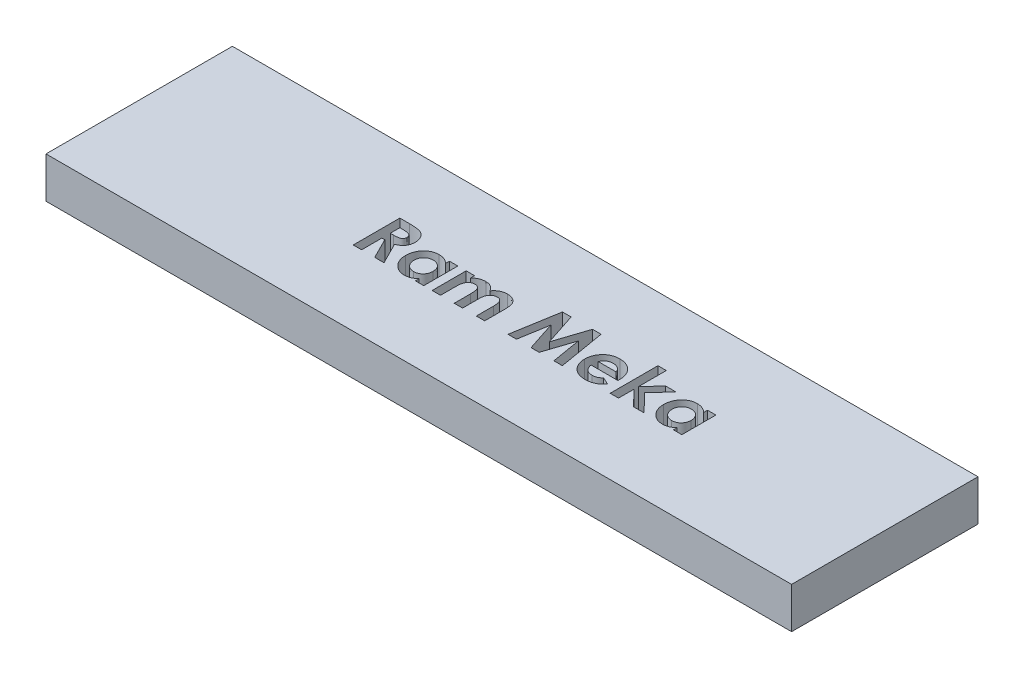
from build123d import *

# Parameters (mm, degrees)
SKETCH1_W           = 50.8
SKETCH1_H           = 12.7
BOSS_EXTRUDE2_DEPTH = 2.794
CUT_EXTRUDE1_DEPTH  = 27.330380476


with BuildPart() as part:
    # Sketch1 → Boss-Extrude2 (new body)
    with BuildSketch(Plane(origin=(0, 0, 0), x_dir=(1, 0, 0), z_dir=(0, 1, 0))):
        Rectangle(SKETCH1_W, SKETCH1_H)
    extrude(amount=-BOSS_EXTRUDE2_DEPTH)

    # Sketch3 → Cut-Extrude1 (cut, through all)
    # profile 1 of 7: a face of its own
    with BuildSketch(Plane(origin=(0, 0, 0), x_dir=(1, 0, 0), z_dir=(0, 1, 0))):
        with BuildLine():
            Line((-9.559377939, 1.918579229), (-8.895375535, 1.918579229))
            add(Edge.make_bspline(
                [(-8.895375535, 1.918579229), (-8.851485178, 1.918423443), (-8.767071659, 1.918123824), (-8.645351975, 1.913396621), (-8.533535705, 1.90681833), (-8.431457297, 1.896779684), (-8.339160421, 1.883469652), (-8.256552573, 1.867779328), (-8.183636169, 1.849896839), (-8.119796259, 1.827613847), (-8.062183896, 1.80247897), (-8.008481165, 1.773598536), (-7.957503303, 1.741294137), (-7.909591041, 1.704715756), (-7.864328012, 1.664521431), (-7.821628823, 1.620670702), (-7.782096854, 1.572791731), (-7.745976888, 1.521187055), (-7.713056446, 1.466900118), (-7.683961681, 1.409856386), (-7.660301769, 1.350016187), (-7.6393957, 1.288244343), (-7.624337737, 1.223657811), (-7.613865143, 1.156885354), (-7.60619752, 1.087691925), (-7.605756668, 1.040684981), (-7.605531785, 1.016706232)],
                knots=[0, 0, 0, 0, 1.749336639, 3.364467119, 4.854658419, 6.213483162, 7.451590619, 8.570285859, 9.5643256, 10.440900261, 11.26203566, 12.067320669, 12.869050712, 13.665104639, 14.467235401, 15.27997916, 16.102287765, 16.939272006, 17.78853747, 18.631303466, 19.488103222, 20.351255419, 21.228522269, 22.127379805, 23.044756219, 24, 24, 24, 24], degree=3))
            add(Edge.make_bspline(
                [(-7.605531785, 1.016706232), (-7.606115951, 0.991677926), (-7.607261393, 0.94260198), (-7.613431369, 0.870513417), (-7.624708148, 0.801544122), (-7.641788469, 0.73589603), (-7.66142008, 0.672752072), (-7.687525086, 0.613277295), (-7.716987166, 0.556606723), (-7.751978417, 0.503541985), (-7.790379607, 0.452904404), (-7.835039382, 0.406634097), (-7.883064476, 0.362244207), (-7.937154553, 0.322515168), (-7.994925274, 0.284760646), (-8.057524482, 0.250544994), (-8.124543632, 0.21900811), (-8.171661414, 0.201420965), (-8.195756144, 0.192427386)],
                knots=[0, 0, 0, 0, 1.099860209, 2.156625411, 3.176576793, 4.16617041, 5.135385252, 6.078461593, 7.016046972, 7.938469504, 8.868247731, 9.803980173, 10.76021508, 11.73834243, 12.748633912, 13.790971185, 14.870363756, 16, 16, 16, 16], degree=3))
            Line((-8.195756144, 0.192427386), (-7.463063836, -1.256420771))
            Line((-7.463063836, -1.256420771), (-8.096537394, -1.256420771))
            Line((-8.096537394, -1.256420771), (-8.796156785, 0.127553588))
            Line((-8.796156785, 0.127553588), (-8.989506144, 0.127553588))
            Line((-8.989506144, 0.127553588), (-8.989506144, -1.256420771))
            Line((-8.989506144, -1.256420771), (-9.559377939, -1.256420771))
            Line((-9.559377939, -1.256420771), (-9.559377939, 1.918579229))
        make_face()
        with BuildLine():
            Line((-8.989506144, 0.697425383), (-8.767535992, 0.697425383))
            add(Edge.make_bspline(
                [(-8.767535992, 0.697425383), (-8.740398296, 0.697731026), (-8.688435438, 0.698316266), (-8.613706025, 0.701030855), (-8.545833896, 0.707571672), (-8.484527584, 0.71583575), (-8.429478604, 0.725377821), (-8.381177971, 0.739052189), (-8.338881447, 0.75370462), (-8.303090247, 0.771913792), (-8.272511068, 0.792621568), (-8.246107904, 0.816146118), (-8.224268702, 0.843372788), (-8.206293925, 0.873561677), (-8.192311503, 0.906979796), (-8.182105405, 0.94326029), (-8.176401706, 0.982816442), (-8.175745476, 1.010115573), (-8.17540358, 1.024338444)],
                knots=[0, 0, 0, 0, 1.688639943, 3.233382647, 4.650958383, 5.928841754, 7.082724185, 8.122798841, 9.049171256, 9.863274652, 10.613301712, 11.341792392, 12.054588806, 12.776240173, 13.521029143, 14.301969904, 15.115324896, 16, 16, 16, 16], degree=3))
            add(Edge.make_bspline(
                [(-8.17540358, 1.024338444), (-8.176049966, 1.041165137), (-8.177319673, 1.074218059), (-8.189919105, 1.121802676), (-8.209974678, 1.165845495), (-8.237465377, 1.206147519), (-8.272086338, 1.241479056), (-8.311816623, 1.272624087), (-8.357513706, 1.297251247), (-8.399825766, 1.313495059), (-8.43831985, 1.3232139), (-8.473059547, 1.330456294), (-8.513288325, 1.335589186), (-8.559036555, 1.341033533), (-8.610187623, 1.344563916), (-8.667020333, 1.347140391), (-8.729371462, 1.348194554), (-8.77283612, 1.348531552), (-8.795520767, 1.348707434)],
                knots=[0, 0, 0, 0, 1.020303359, 2.004196876, 2.966617323, 3.9489082, 4.950758222, 5.960522915, 7.003732012, 8.091992268, 8.70421221, 9.413913587, 10.24622431, 11.166358409, 12.212345909, 13.359657661, 14.621978493, 16, 16, 16, 16], degree=3))
            Line((-8.795520767, 1.348707434), (-8.989506144, 1.348707434))
            Line((-8.989506144, 1.348707434), (-8.989506144, 0.697425383))
        make_face(mode=Mode.SUBTRACT)
    # profile 2 of 7: a face of its own
    with BuildSketch(Plane(origin=(0, 0, 0), x_dir=(1, 0, 0), z_dir=(0, 1, 0))):
        with BuildLine():
            Line((-5.326044606, 1.063771536), (-4.756172811, 1.063771536))
            Line((-4.756172811, 1.063771536), (-4.756172811, -1.256420771))
            Line((-4.756172811, -1.256420771), (-5.326044606, -1.256420771))
            Line((-5.326044606, -1.256420771), (-5.326044606, -1.003285755))
            add(Edge.make_bspline(
                [(-5.326044606, -1.003285755), (-5.354281543, -1.027925647), (-5.409083862, -1.075746812), (-5.495434585, -1.13779599), (-5.582037634, -1.188978541), (-5.66930914, -1.229742653), (-5.758590429, -1.259842753), (-5.850524291, -1.281635929), (-5.946434671, -1.294487898), (-6.011633226, -1.296237406), (-6.044744525, -1.297125899)],
                knots=[0, 0, 0, 0, 1.129196829, 2.191548051, 3.199897424, 4.157751732, 5.089409408, 6.034969131, 7.002052659, 8, 8, 8, 8], degree=3))
            add(Edge.make_bspline(
                [(-6.044744525, -1.297125899), (-6.081913431, -1.296289715), (-6.155361293, -1.294637368), (-6.263137878, -1.277243748), (-6.367206886, -1.250618935), (-6.467483841, -1.212941498), (-6.563786298, -1.164118925), (-6.656851265, -1.105425067), (-6.745083323, -1.034799417), (-6.829216974, -0.955297767), (-6.90624924, -0.867845387), (-6.973591574, -0.773656104), (-7.030356157, -0.674065783), (-7.076860342, -0.569404614), (-7.113441889, -0.459749412), (-7.139519298, -0.344752384), (-7.154904999, -0.224372457), (-7.156809315, -0.142374366), (-7.157775375, -0.100776741)],
                knots=[0, 0, 0, 0, 0.980476535, 1.937477201, 2.874147792, 3.812856188, 4.758993464, 5.720109578, 6.712210464, 7.737600662, 8.772720504, 9.783789959, 10.789002326, 11.793715968, 12.802552247, 13.835794126, 14.902098527, 16, 16, 16, 16], degree=3))
            add(Edge.make_bspline(
                [(-7.157775375, -0.100776741), (-7.156761492, -0.057702345), (-7.154772647, 0.026792882), (-7.140224368, 0.15078561), (-7.114628186, 0.26863398), (-7.079725951, 0.38050123), (-7.034830287, 0.486406686), (-6.980150368, 0.586523856), (-6.914942325, 0.680591048), (-6.839801615, 0.767007173), (-6.758668104, 0.846211726), (-6.67186959, 0.91516557), (-6.580763412, 0.97374507), (-6.485252754, 1.021568674), (-6.385351256, 1.058524335), (-6.281453327, 1.085541941), (-6.173097733, 1.101753453), (-6.099285024, 1.103561389), (-6.061917001, 1.104476665)],
                knots=[0, 0, 0, 0, 1.136281865, 2.228943489, 3.287578264, 4.313574083, 5.316051562, 6.317280042, 7.318008486, 8.329309503, 9.333984563, 10.305318864, 11.248632312, 12.186624717, 13.117503092, 14.05354244, 15.014596925, 16, 16, 16, 16], degree=3))
            add(Edge.make_bspline(
                [(-6.061917001, 1.104476665), (-6.027302104, 1.103757533), (-5.9588117, 1.102334631), (-5.858140675, 1.086884633), (-5.760504299, 1.063517608), (-5.666435186, 1.030223804), (-5.575161748, 0.988183603), (-5.488253947, 0.935504098), (-5.403810595, 0.874399384), (-5.352286874, 0.826675309), (-5.326044606, 0.802368291)],
                knots=[0, 0, 0, 0, 1.017011718, 2.012299608, 2.98747302, 3.965332399, 4.941441765, 5.936729654, 6.94912688, 8, 8, 8, 8], degree=3))
            Line((-5.326044606, 0.802368291), (-5.326044606, 1.063771536))
        make_face()
        with BuildLine():
            add(Edge.make_bspline(
                [(-5.942345687, 0.575309998), (-5.965053398, 0.574613247), (-6.00955903, 0.573247661), (-6.075010651, 0.565033563), (-6.137562766, 0.550559958), (-6.196769259, 0.529178313), (-6.253512523, 0.503132355), (-6.306930903, 0.470510222), (-6.357465277, 0.431951553), (-6.404818448, 0.388389854), (-6.44798784, 0.340507582), (-6.485202375, 0.288257649), (-6.516828718, 0.233047893), (-6.543576385, 0.174712319), (-6.562721645, 0.112560635), (-6.577884684, 0.047401947), (-6.585753319, -0.021296059), (-6.587179655, -0.068111625), (-6.58790358, -0.091872494)],
                knots=[0, 0, 0, 0, 1.04836806, 2.054732945, 3.03993516, 4.00574415, 4.955904794, 5.917688631, 6.888591924, 7.88601754, 8.884115178, 9.859153345, 10.841239365, 11.818093293, 12.814750328, 13.83810466, 14.90274714, 16, 16, 16, 16], degree=3))
            add(Edge.make_bspline(
                [(-6.58790358, -0.091872494), (-6.587190713, -0.115848888), (-6.585786016, -0.163094095), (-6.577757456, -0.232371594), (-6.563140046, -0.298482097), (-6.541813796, -0.360891148), (-6.515769498, -0.42044085), (-6.484067731, -0.476856375), (-6.445127662, -0.529140227), (-6.401920428, -0.578529617), (-6.353595814, -0.622632426), (-6.302775496, -0.661791671), (-6.248765307, -0.694556186), (-6.192151221, -0.721036674), (-6.133123803, -0.742616046), (-6.070943027, -0.756907748), (-6.006218033, -0.766044163), (-5.962093296, -0.767316468), (-5.939801617, -0.767959233)],
                knots=[0, 0, 0, 0, 1.099136573, 2.165835871, 3.191374663, 4.196217796, 5.183857741, 6.167377911, 7.154730987, 8.166690795, 9.170734848, 10.148332609, 11.103258353, 12.059567475, 13.009337315, 13.978056681, 14.978520572, 16, 16, 16, 16], degree=3))
            add(Edge.make_bspline(
                [(-5.939801617, -0.767959233), (-5.916670948, -0.767258576), (-5.871322263, -0.765884907), (-5.804802831, -0.757745772), (-5.741410417, -0.743219098), (-5.681408766, -0.721715039), (-5.62388141, -0.695856039), (-5.569347481, -0.663871367), (-5.518398756, -0.625401179), (-5.470777203, -0.581445681), (-5.427141229, -0.533172422), (-5.389412046, -0.480237314), (-5.356548547, -0.424333368), (-5.330702917, -0.36413881), (-5.310177863, -0.300706764), (-5.29545161, -0.233643558), (-5.287441382, -0.162876889), (-5.286048971, -0.11457588), (-5.285339477, -0.089964441)],
                knots=[0, 0, 0, 0, 1.050008698, 2.058587853, 3.036635738, 3.995319155, 4.947022481, 5.895997462, 6.858296291, 7.838991643, 8.833936038, 9.806048392, 10.784806122, 11.771666913, 12.772873988, 13.80724452, 14.882696879, 16, 16, 16, 16], degree=3))
            add(Edge.make_bspline(
                [(-5.285339477, -0.089964441), (-5.286040154, -0.065776307), (-5.28740878, -0.018529855), (-5.295486156, 0.050759239), (-5.310316957, 0.11650563), (-5.330419572, 0.178830168), (-5.356725003, 0.237590349), (-5.389613367, 0.292134663), (-5.426928683, 0.344352865), (-5.47104777, 0.391321997), (-5.518411347, 0.434959223), (-5.570109356, 0.472266044), (-5.624513028, 0.504418097), (-5.681956621, 0.530816173), (-5.742972037, 0.550166963), (-5.806472785, 0.565149572), (-5.873449608, 0.573242731), (-5.919005559, 0.574609664), (-5.942345687, 0.575309998)],
                knots=[0, 0, 0, 0, 1.106611376, 2.161533483, 3.185006901, 4.184773755, 5.152708835, 6.122342771, 7.094156588, 8.082475533, 9.064254463, 10.03606828, 10.992420271, 11.951521816, 12.920622147, 13.915721683, 14.932141191, 16, 16, 16, 16], degree=3))
        make_face(mode=Mode.SUBTRACT)
    # profile 3 of 7: a face of its own
    with BuildSketch(Plane(origin=(0, 0, 0), x_dir=(1, 0, 0), z_dir=(0, 1, 0))):
        with BuildLine():
            Line((-4.186301016, 1.063771536), (-3.616429221, 1.063771536))
            Line((-3.616429221, 1.063771536), (-3.616429221, 0.786467851))
            add(Edge.make_bspline(
                [(-3.616429221, 0.786467851), (-3.591081613, 0.812050871), (-3.541174256, 0.862421736), (-3.458468004, 0.927178011), (-3.372197008, 0.982552626), (-3.2813158, 1.027381863), (-3.186046673, 1.061612222), (-3.086841152, 1.086695725), (-2.983189677, 1.101494206), (-2.912617032, 1.103471492), (-2.876740719, 1.104476665)],
                knots=[0, 0, 0, 0, 1.041528618, 2.050684245, 3.032913108, 4.004406485, 4.976926473, 5.95771665, 6.961784757, 8, 8, 8, 8], degree=3))
            add(Edge.make_bspline(
                [(-2.876740719, 1.104476665), (-2.840817037, 1.103346705), (-2.770102431, 1.101122416), (-2.666930313, 1.080768084), (-2.569191215, 1.047699174), (-2.477960497, 1.000563505), (-2.392578797, 0.942353404), (-2.31682858, 0.870061554), (-2.248644282, 0.786565737), (-2.212299426, 0.723442001), (-2.193657787, 0.691065206)],
                knots=[0, 0, 0, 0, 1.023965777, 2.015643508, 2.987309376, 3.958410333, 4.93654923, 5.924956801, 6.93568961, 8, 8, 8, 8], degree=3))
            add(Edge.make_bspline(
                [(-2.193657787, 0.691065206), (-2.169644946, 0.723530078), (-2.122514478, 0.787249512), (-2.038971431, 0.870442457), (-1.948636472, 0.942360943), (-1.849761827, 1.000993253), (-1.744973265, 1.047538284), (-1.634729327, 1.080645215), (-1.520029521, 1.101088398), (-1.441970009, 1.10333786), (-1.402451857, 1.104476665)],
                knots=[0, 0, 0, 0, 1.041189987, 2.043563759, 3.033412161, 4.015238574, 5.00275396, 5.986226558, 6.980513695, 8, 8, 8, 8], degree=3))
            add(Edge.make_bspline(
                [(-1.402451857, 1.104476665), (-1.3616343, 1.103294191), (-1.282145901, 1.100991434), (-1.166955796, 1.078336335), (-1.059066324, 1.043330808), (-0.960861812, 0.992389199), (-0.87206217, 0.932046845), (-0.796394163, 0.860749836), (-0.733596632, 0.780986029), (-0.692707386, 0.706506096), (-0.666273586, 0.640657306), (-0.650312624, 0.58335652), (-0.635384185, 0.519372946), (-0.624659596, 0.447846554), (-0.614648666, 0.369449636), (-0.608836927, 0.283660984), (-0.604886627, 0.190769599), (-0.604467056, 0.126498556), (-0.604249734, 0.093208636)],
                knots=[0, 0, 0, 0, 1.321991808, 2.574456155, 3.791773975, 4.987670122, 6.148905103, 7.262530793, 8.344737981, 9.427709016, 10.004683293, 10.642050061, 11.354108788, 12.133887687, 12.985666279, 13.916212488, 14.92067847, 16, 16, 16, 16], degree=3))
            Line((-0.604249734, 0.093208636), (-0.604249734, -1.256420771))
            Line((-0.604249734, -1.256420771), (-1.174121529, -1.256420771))
            Line((-1.174121529, -1.256420771), (-1.174121529, -0.091236476))
            add(Edge.make_bspline(
                [(-1.174121529, -0.091236476), (-1.174595839, -0.060069962), (-1.175506235, -0.000248655), (-1.179376678, 0.085553589), (-1.188040386, 0.163368821), (-1.198195362, 0.233628062), (-1.212727328, 0.295958792), (-1.230446423, 0.350511266), (-1.251000464, 0.39736401), (-1.27581885, 0.436512141), (-1.303615472, 0.469481052), (-1.334535203, 0.497741937), (-1.368255659, 0.521854064), (-1.405082565, 0.542406226), (-1.445980691, 0.55630606), (-1.489569382, 0.567212366), (-1.536189732, 0.574639638), (-1.568423031, 0.575082431), (-1.584988916, 0.575309998)],
                knots=[0, 0, 0, 0, 1.669139205, 3.203761885, 4.596586177, 5.860166715, 7.002923539, 8.018877315, 8.928339525, 9.734594377, 10.491888885, 11.231098709, 11.971440889, 12.708030942, 13.480072485, 14.275788656, 15.113863979, 16, 16, 16, 16], degree=3))
            add(Edge.make_bspline(
                [(-1.584988916, 0.575309998), (-1.610516711, 0.574427436), (-1.660609929, 0.572695584), (-1.733605956, 0.556145795), (-1.802295756, 0.529088662), (-1.866421988, 0.492279829), (-1.924604798, 0.446306291), (-1.975500028, 0.391777293), (-2.01753239, 0.328378577), (-2.046628216, 0.269557286), (-2.064809452, 0.21637102), (-2.077634662, 0.170821254), (-2.087631403, 0.119311206), (-2.095455925, 0.062362554), (-2.10296264, -0.000346638), (-2.106645392, -0.068737073), (-2.110413971, -0.142713741), (-2.110364912, -0.193841135), (-2.110339477, -0.220348055)],
                knots=[0, 0, 0, 0, 1.129913425, 2.217230253, 3.297175357, 4.391411011, 5.481605898, 6.571841268, 7.681894157, 8.841607612, 9.468549532, 10.170608623, 10.93710061, 11.791434153, 12.717934886, 13.734733707, 14.825576123, 16, 16, 16, 16], degree=3))
            Line((-2.110339477, -0.220348055), (-2.110339477, -1.256420771))
            Line((-2.110339477, -1.256420771), (-2.680211272, -1.256420771))
            Line((-2.680211272, -1.256420771), (-2.680211272, -0.14402594))
            add(Edge.make_bspline(
                [(-2.680211272, -0.14402594), (-2.680259119, -0.11921807), (-2.68035116, -0.071495765), (-2.68311774, -0.002583844), (-2.686781231, 0.061046866), (-2.69191702, 0.11957384), (-2.697840141, 0.172924286), (-2.70638857, 0.22080634), (-2.715369483, 0.263483847), (-2.73076738, 0.31196422), (-2.752464997, 0.365688588), (-2.784881554, 0.422660288), (-2.824077598, 0.470360661), (-2.869062453, 0.509160916), (-2.919897269, 0.538723597), (-2.975294242, 0.560714557), (-3.036311143, 0.572584603), (-3.078311098, 0.574382362), (-3.099982907, 0.575309998)],
                knots=[0, 0, 0, 0, 1.256487322, 2.417074606, 3.49288742, 4.484586665, 5.393016842, 6.210437544, 6.947749329, 7.599905853, 8.784490193, 9.876739139, 10.906602197, 11.896672079, 12.869113195, 13.872201355, 14.902064413, 16, 16, 16, 16], degree=3))
            add(Edge.make_bspline(
                [(-3.099982907, 0.575309998), (-3.124470186, 0.574478857), (-3.172967447, 0.572832776), (-3.243611117, 0.555152519), (-3.311153017, 0.528591834), (-3.374107293, 0.490756347), (-3.431413575, 0.443700912), (-3.481799236, 0.387620882), (-3.523610702, 0.322582776), (-3.552835679, 0.262138984), (-3.570751811, 0.207625794), (-3.583921872, 0.160893285), (-3.593546671, 0.10824887), (-3.601577079, 0.050283652), (-3.609039351, -0.01307079), (-3.612737341, -0.082093066), (-3.616502197, -0.156706668), (-3.616454133, -0.208257655), (-3.616429221, -0.23497646)],
                knots=[0, 0, 0, 0, 1.07893236, 2.136834559, 3.195274846, 4.273923004, 5.364443877, 6.458052972, 7.587287137, 8.767908, 9.410170275, 10.118584836, 10.909717261, 11.770069756, 12.702352573, 13.724628867, 14.820678298, 16, 16, 16, 16], degree=3))
            Line((-3.616429221, -0.23497646), (-3.616429221, -1.256420771))
            Line((-3.616429221, -1.256420771), (-4.186301016, -1.256420771))
            Line((-4.186301016, -1.256420771), (-4.186301016, 1.063771536))
        make_face()
    # profile 4 of 7: a face of its own
    with BuildSketch(Plane(origin=(0, 0, 0), x_dir=(1, 0, 0), z_dir=(0, 1, 0))):
        Polygon((1.519413127, 1.918579229), (2.110909521, 1.918579229), (2.8353336, -0.296034153), (3.564845819, 1.918579229), (4.150618055, 1.918579229), (4.687416933, -1.256420771), (4.110548944, -1.256420771), (3.771551548, 0.74894281), (3.11136525, -1.256420771), (2.555485843, -1.256420771), (1.899115651, 0.74894281), (1.560754273, -1.256420771), (0.983250266, -1.256420771), align=None)
    # profile 5 of 7: a face of its own
    with BuildSketch(Plane(origin=(0, 0, 0), x_dir=(1, 0, 0), z_dir=(0, 1, 0))):
        with BuildLine():
            Line((7.453457598, -0.238792566), (5.623634882, -0.238792566))
            add(Edge.make_bspline(
                [(5.623634882, -0.238792566), (5.627365742, -0.260054068), (5.634697178, -0.301834597), (5.650617651, -0.36252444), (5.670934563, -0.419717524), (5.695283102, -0.473490301), (5.723252753, -0.524127048), (5.755877033, -0.571390259), (5.792742134, -0.615238186), (5.83363491, -0.655480263), (5.877873755, -0.691538036), (5.925244125, -0.723126925), (5.975794904, -0.749027881), (6.028946547, -0.7708597), (6.085096218, -0.788152712), (6.144326556, -0.800079373), (6.206480549, -0.807124496), (6.248821748, -0.808143492), (6.27046481, -0.808664361)],
                knots=[0, 0, 0, 0, 1.091296461, 2.144483647, 3.168565212, 4.157007626, 5.126487748, 6.090021542, 7.05641414, 8.019231907, 8.98705074, 9.938580405, 10.892824166, 11.854447369, 12.841318655, 13.858982407, 14.905600794, 16, 16, 16, 16], degree=3))
            add(Edge.make_bspline(
                [(6.27046481, -0.808664361), (6.296589454, -0.807974645), (6.348036571, -0.806616391), (6.423406982, -0.794570699), (6.496301148, -0.776376211), (6.566029234, -0.749319479), (6.63339893, -0.715638604), (6.697301124, -0.673676379), (6.758841914, -0.624659076), (6.796389047, -0.586876557), (6.815531917, -0.56761368)],
                knots=[0, 0, 0, 0, 1.021034703, 2.010718019, 2.977989445, 3.954245119, 4.929443971, 5.918328161, 6.938689359, 8, 8, 8, 8], degree=3))
            Line((6.815531917, -0.56761368), (7.292545138, -0.794671973))
            add(Edge.make_bspline(
                [(7.292545138, -0.794671973), (7.277526655, -0.815425211), (7.247768084, -0.85654699), (7.199188214, -0.914415953), (7.148492027, -0.968410043), (7.095641714, -1.018174133), (7.040570246, -1.063566414), (6.983430819, -1.105139848), (6.923388364, -1.141778203), (6.861643419, -1.175254021), (6.796919602, -1.203952685), (6.729396031, -1.228425893), (6.659358708, -1.250549464), (6.585923213, -1.267406413), (6.509701041, -1.280750237), (6.430509855, -1.29022612), (6.348360091, -1.296078918), (6.292523375, -1.29677276), (6.264104633, -1.297125899)],
                knots=[0, 0, 0, 0, 1.028154879, 2.037251081, 3.030720504, 4.000128189, 4.949298328, 5.894184978, 6.834267904, 7.770992897, 8.712077017, 9.673380525, 10.653304757, 11.658697181, 12.695551717, 13.758623199, 14.859225354, 16, 16, 16, 16], degree=3))
            add(Edge.make_bspline(
                [(6.264104633, -1.297125899), (6.220382865, -1.296234544), (6.134756302, -1.294488876), (6.009511974, -1.278286579), (5.8905646, -1.251421423), (5.777578315, -1.21490237), (5.67104152, -1.166685779), (5.57090149, -1.107712889), (5.476157683, -1.039114328), (5.389705051, -0.959450394), (5.310944152, -0.872740938), (5.241765476, -0.779620904), (5.183877745, -0.680740886), (5.136339176, -0.576755292), (5.099390548, -0.46739796), (5.072752731, -0.352621169), (5.05642343, -0.232479738), (5.054659785, -0.150650013), (5.053763087, -0.10904497)],
                knots=[0, 0, 0, 0, 1.103565453, 2.161269334, 3.182010356, 4.179077853, 5.15417608, 6.128274628, 7.109042802, 8.101804412, 9.090965879, 10.063106201, 11.02526161, 11.978650795, 12.945248442, 13.93468508, 14.949922959, 16, 16, 16, 16], degree=3))
            add(Edge.make_bspline(
                [(5.053763087, -0.10904497), (5.05466861, -0.06638269), (5.056450187, 0.017553431), (5.072612136, 0.140468983), (5.099464193, 0.257747043), (5.136520903, 0.369549118), (5.183338306, 0.476224876), (5.241962559, 0.576841032), (5.310909822, 0.671747876), (5.389386986, 0.760501425), (5.476205858, 0.840611199), (5.568459113, 0.912005018), (5.667183308, 0.971495086), (5.77126179, 1.019563024), (5.880028835, 1.058617011), (5.994741637, 1.084604177), (6.114527408, 1.102053004), (6.196410322, 1.103659932), (6.23802791, 1.104476665)],
                knots=[0, 0, 0, 0, 1.079208495, 2.12329425, 3.130605359, 4.119693003, 5.099659317, 6.073216462, 7.060498243, 8.06384408, 9.066070512, 10.045757761, 11.010926815, 11.975797609, 12.942977511, 13.929384301, 14.947594487, 16, 16, 16, 16], degree=3))
            add(Edge.make_bspline(
                [(6.23802791, 1.104476665), (6.281959136, 1.103571481), (6.368213569, 1.101794245), (6.494330185, 1.085723506), (6.614067355, 1.05869453), (6.727935226, 1.022491251), (6.834479659, 0.973056658), (6.936041758, 0.915534997), (7.030185488, 0.845453626), (7.117914321, 0.766179542), (7.197107522, 0.678227693), (7.266331155, 0.582685048), (7.325231946, 0.480484045), (7.372971622, 0.37121024), (7.40988231, 0.255191681), (7.436544785, 0.132579043), (7.452749533, 0.002905965), (7.454480361, -0.085888623), (7.455365651, -0.131305587)],
                knots=[0, 0, 0, 0, 1.080001299, 2.120471247, 3.119684163, 4.095710327, 5.052285597, 6.002875087, 6.961153713, 7.931888285, 8.906493152, 9.865905668, 10.82813294, 11.801621613, 12.7925306, 13.817193356, 14.883530496, 16, 16, 16, 16], degree=3))
            Line((7.455365651, -0.131305587), (7.453457598, -0.238792566))
        make_face()
        with BuildLine():
            add(Edge.make_bspline(
                [(6.885493856, 0.208963844), (6.874740027, 0.237984073), (6.853358613, 0.295683849), (6.805058888, 0.37529546), (6.740966699, 0.444242348), (6.666422885, 0.505281575), (6.58125191, 0.554824825), (6.488137661, 0.590695746), (6.388257083, 0.612204401), (6.319544628, 0.614726988), (6.284457197, 0.616015126)],
                knots=[0, 0, 0, 0, 0.954238005, 1.897273737, 2.851915805, 3.847685534, 4.862635127, 5.880135777, 6.917509367, 8, 8, 8, 8], degree=3))
            add(Edge.make_bspline(
                [(6.284457197, 0.616015126), (6.24613601, 0.614777713), (6.171226069, 0.612358828), (6.063173578, 0.586633097), (5.961250367, 0.548238213), (5.901162219, 0.508652272), (5.871045739, 0.488811601)],
                knots=[0, 0, 0, 0, 1.044195649, 2.041185066, 3.018232172, 4, 4, 4, 4], degree=3))
            add(Edge.make_bspline(
                [(5.871045739, 0.488811601), (5.852255305, 0.473700511), (5.812195059, 0.441484439), (5.760168704, 0.377216436), (5.70892231, 0.299402311), (5.67978591, 0.240296986), (5.66434001, 0.208963844)],
                knots=[0, 0, 0, 0, 0.82159062, 1.751589201, 2.808063854, 4, 4, 4, 4], degree=3))
            Line((5.66434001, 0.208963844), (6.885493856, 0.208963844))
        make_face(mode=Mode.SUBTRACT)
    # profile 6 of 7: a face of its own
    with BuildSketch(Plane(origin=(0, 0, 0), x_dir=(1, 0, 0), z_dir=(0, 1, 0))):
        Polygon((7.943827189, 1.999989485), (8.513698984, 1.999989485), (8.513698984, 0.100840847), (9.400307558, 1.063771536), (10.104379072, 1.063771536), (9.08611485, -0.042263119), (10.250027109, -1.256420771), (9.532599225, -1.256420771), (8.513698984, -0.193635315), (8.513698984, -1.256420771), (7.943827189, -1.256420771), align=None)
    # profile 7 of 7: a face of its own
    with BuildSketch(Plane(origin=(0, 0, 0), x_dir=(1, 0, 0), z_dir=(0, 1, 0))):
        with BuildLine():
            Line((12.258570779, 1.063771536), (12.828442574, 1.063771536))
            Line((12.828442574, 1.063771536), (12.828442574, -1.256420771))
            Line((12.828442574, -1.256420771), (12.258570779, -1.256420771))
            Line((12.258570779, -1.256420771), (12.258570779, -1.003285755))
            add(Edge.make_bspline(
                [(12.258570779, -1.003285755), (12.230333842, -1.027925647), (12.175531522, -1.075746812), (12.0891808, -1.13779599), (12.002577751, -1.188978541), (11.915306245, -1.229742653), (11.826024955, -1.259842753), (11.734091093, -1.281635929), (11.638180713, -1.294487898), (11.572982158, -1.296237406), (11.539870859, -1.297125899)],
                knots=[0, 0, 0, 0, 1.129196829, 2.191548051, 3.199897424, 4.157751732, 5.089409408, 6.034969131, 7.002052659, 8, 8, 8, 8], degree=3))
            add(Edge.make_bspline(
                [(11.539870859, -1.297125899), (11.502701954, -1.296289715), (11.429254091, -1.294637368), (11.321477506, -1.277243748), (11.217408499, -1.250618935), (11.117131544, -1.212941498), (11.020829086, -1.164118925), (10.92776412, -1.105425067), (10.839532062, -1.034799417), (10.755398411, -0.955297767), (10.678366145, -0.867845387), (10.611023811, -0.773656104), (10.554259228, -0.674065783), (10.507755042, -0.569404614), (10.471173495, -0.459749412), (10.445096087, -0.344752384), (10.429710386, -0.224372457), (10.427806069, -0.142374366), (10.42684001, -0.100776741)],
                knots=[0, 0, 0, 0, 0.980476535, 1.937477201, 2.874147792, 3.812856188, 4.758993464, 5.720109578, 6.712210464, 7.737600662, 8.772720504, 9.783789959, 10.789002326, 11.793715968, 12.802552247, 13.835794126, 14.902098527, 16, 16, 16, 16], degree=3))
            add(Edge.make_bspline(
                [(10.42684001, -0.100776741), (10.427853893, -0.057702345), (10.429842737, 0.026792882), (10.444391017, 0.15078561), (10.469987199, 0.26863398), (10.504889433, 0.38050123), (10.549785097, 0.486406686), (10.604465017, 0.586523856), (10.66967306, 0.680591048), (10.74481377, 0.767007173), (10.825947281, 0.846211726), (10.912745795, 0.91516557), (11.003851973, 0.97374507), (11.099362631, 1.021568674), (11.199264129, 1.058524335), (11.303162058, 1.085541941), (11.411517652, 1.101753453), (11.485330361, 1.103561389), (11.522698383, 1.104476665)],
                knots=[0, 0, 0, 0, 1.136281865, 2.228943489, 3.287578264, 4.313574083, 5.316051562, 6.317280042, 7.318008486, 8.329309503, 9.333984563, 10.305318864, 11.248632312, 12.186624717, 13.117503092, 14.05354244, 15.014596925, 16, 16, 16, 16], degree=3))
            add(Edge.make_bspline(
                [(11.522698383, 1.104476665), (11.55731328, 1.103757533), (11.625803684, 1.102334631), (11.72647471, 1.086884633), (11.824111085, 1.063517608), (11.918180199, 1.030223804), (12.009453637, 0.988183603), (12.096361438, 0.935504098), (12.180804789, 0.874399384), (12.232328511, 0.826675309), (12.258570779, 0.802368291)],
                knots=[0, 0, 0, 0, 1.017011718, 2.012299608, 2.98747302, 3.965332399, 4.941441765, 5.936729654, 6.94912688, 8, 8, 8, 8], degree=3))
            Line((12.258570779, 0.802368291), (12.258570779, 1.063771536))
        make_face()
        with BuildLine():
            add(Edge.make_bspline(
                [(11.642269697, 0.575309998), (11.619561986, 0.574613247), (11.575056355, 0.573247661), (11.509604734, 0.565033563), (11.447052618, 0.550559958), (11.387846126, 0.529178313), (11.331102862, 0.503132355), (11.277684482, 0.470510222), (11.227150107, 0.431951553), (11.179796937, 0.388389854), (11.136627545, 0.340507582), (11.099413009, 0.288257649), (11.067786667, 0.233047893), (11.041039, 0.174712319), (11.021893739, 0.112560635), (11.006730701, 0.047401947), (10.998862066, -0.021296059), (10.99743573, -0.068111625), (10.996711805, -0.091872494)],
                knots=[0, 0, 0, 0, 1.04836806, 2.054732945, 3.03993516, 4.00574415, 4.955904794, 5.917688631, 6.888591924, 7.88601754, 8.884115178, 9.859153345, 10.841239365, 11.818093293, 12.814750328, 13.83810466, 14.90274714, 16, 16, 16, 16], degree=3))
            add(Edge.make_bspline(
                [(10.996711805, -0.091872494), (10.997424672, -0.115848888), (10.998829368, -0.163094095), (11.006857929, -0.232371594), (11.021475339, -0.298482097), (11.042801589, -0.360891148), (11.068845886, -0.42044085), (11.100547654, -0.476856375), (11.139487722, -0.529140227), (11.182694957, -0.578529617), (11.23101957, -0.622632426), (11.281839889, -0.661791671), (11.335850077, -0.694556186), (11.392464164, -0.721036674), (11.451491582, -0.742616046), (11.513672358, -0.756907748), (11.578397351, -0.766044163), (11.622522089, -0.767316468), (11.644813768, -0.767959233)],
                knots=[0, 0, 0, 0, 1.099136573, 2.165835871, 3.191374663, 4.196217796, 5.183857741, 6.167377911, 7.154730987, 8.166690795, 9.170734848, 10.148332609, 11.103258353, 12.059567475, 13.009337315, 13.978056681, 14.978520572, 16, 16, 16, 16], degree=3))
            add(Edge.make_bspline(
                [(11.644813768, -0.767959233), (11.667944437, -0.767258576), (11.713293122, -0.765884907), (11.779812553, -0.757745772), (11.843204968, -0.743219098), (11.903206619, -0.721715039), (11.960733975, -0.695856039), (12.015267903, -0.663871367), (12.066216628, -0.625401179), (12.113838182, -0.581445681), (12.157474156, -0.533172422), (12.195203339, -0.480237314), (12.228066838, -0.424333368), (12.253912467, -0.36413881), (12.274437522, -0.300706764), (12.289163775, -0.233643558), (12.297174003, -0.162876889), (12.298566414, -0.11457588), (12.299275907, -0.089964441)],
                knots=[0, 0, 0, 0, 1.050008698, 2.058587853, 3.036635738, 3.995319155, 4.947022481, 5.895997462, 6.858296291, 7.838991643, 8.833936038, 9.806048392, 10.784806122, 11.771666913, 12.772873988, 13.80724452, 14.882696879, 16, 16, 16, 16], degree=3))
            add(Edge.make_bspline(
                [(12.299275907, -0.089964441), (12.29857523, -0.065776307), (12.297206604, -0.018529855), (12.289129229, 0.050759239), (12.274298428, 0.11650563), (12.254195813, 0.178830168), (12.227890381, 0.237590349), (12.195002017, 0.292134663), (12.157686702, 0.344352865), (12.113567614, 0.391321997), (12.066204038, 0.434959223), (12.014506029, 0.472266044), (11.960102357, 0.504418097), (11.902658763, 0.530816173), (11.841643348, 0.550166963), (11.7781426, 0.565149572), (11.711165776, 0.573242731), (11.665609826, 0.574609664), (11.642269697, 0.575309998)],
                knots=[0, 0, 0, 0, 1.106611376, 2.161533483, 3.185006901, 4.184773755, 5.152708835, 6.122342771, 7.094156588, 8.082475533, 9.064254463, 10.03606828, 10.992420271, 11.951521816, 12.920622147, 13.915721683, 14.932141191, 16, 16, 16, 16], degree=3))
        make_face(mode=Mode.SUBTRACT)
    extrude(amount=-CUT_EXTRUDE1_DEPTH, mode=Mode.SUBTRACT)


with BuildPart() as cut_extrude1_piece_1:
    # of the separate pieces the step leaves, piece 1, a body of its own (cut_extrude1_pieces)
    add(part.part.solids().sort_by_distance((-25.4, 0, 6.35))[0])


with BuildPart() as cut_extrude1_piece_2:
    # of the separate pieces the step leaves, piece 2, a body of its own (cut_extrude1_pieces)
    add(part.part.solids().sort_by_distance((11.642269697, 0, -0.575309998))[0])


with BuildPart() as cut_extrude1_piece_3:
    # of the separate pieces the step leaves, piece 3, a body of its own (cut_extrude1_pieces)
    add(part.part.solids().sort_by_distance((-5.942345687, 0, -0.575309998))[0])


with BuildPart() as cut_extrude1_piece_4:
    # of the separate pieces the step leaves, piece 4, a body of its own (cut_extrude1_pieces)
    add(part.part.solids().sort_by_distance((-8.989506144, 0, -0.697425383))[0])


with BuildPart() as cut_extrude1_piece_5:
    # of the separate pieces the step leaves, piece 5, a body of its own (cut_extrude1_pieces)
    add(part.part.solids().sort_by_distance((6.885493856, 0, -0.208963844))[0])


solid = Compound([cut_extrude1_piece_1.part, cut_extrude1_piece_2.part, cut_extrude1_piece_3.part, cut_extrude1_piece_4.part, cut_extrude1_piece_5.part])
